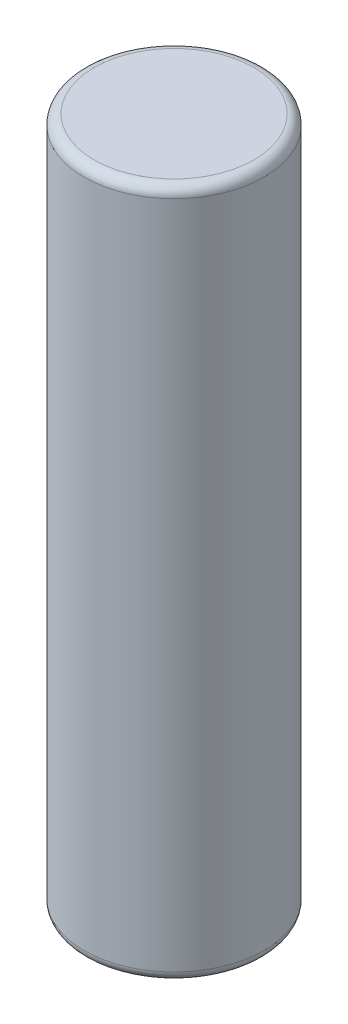
from build123d import *

# Parameters (mm, degrees)
SKETCH1_R           = 9
BOSS_EXTRUDE1_DEPTH = 69
FILLET1_R           = 1


with BuildPart() as part:
    # Sketch1 → Boss-Extrude1 (new body)
    with BuildSketch(Plane(origin=(0, 0, 0), x_dir=(1, 0, 0), z_dir=(0, 1, 0))):
        with Locations(Location((0, 0, 0), (0, 0, 270))):
            Circle(SKETCH1_R)
    extrude(amount=BOSS_EXTRUDE1_DEPTH)

    # Fillet1
    fillet1_edges = [part.edges().sort_by_distance(p)[0] for p in [
        (0, 0, -9),
        (0, 69, -9),
    ]]
    fillet(fillet1_edges, radius=FILLET1_R)


solid = part.part
